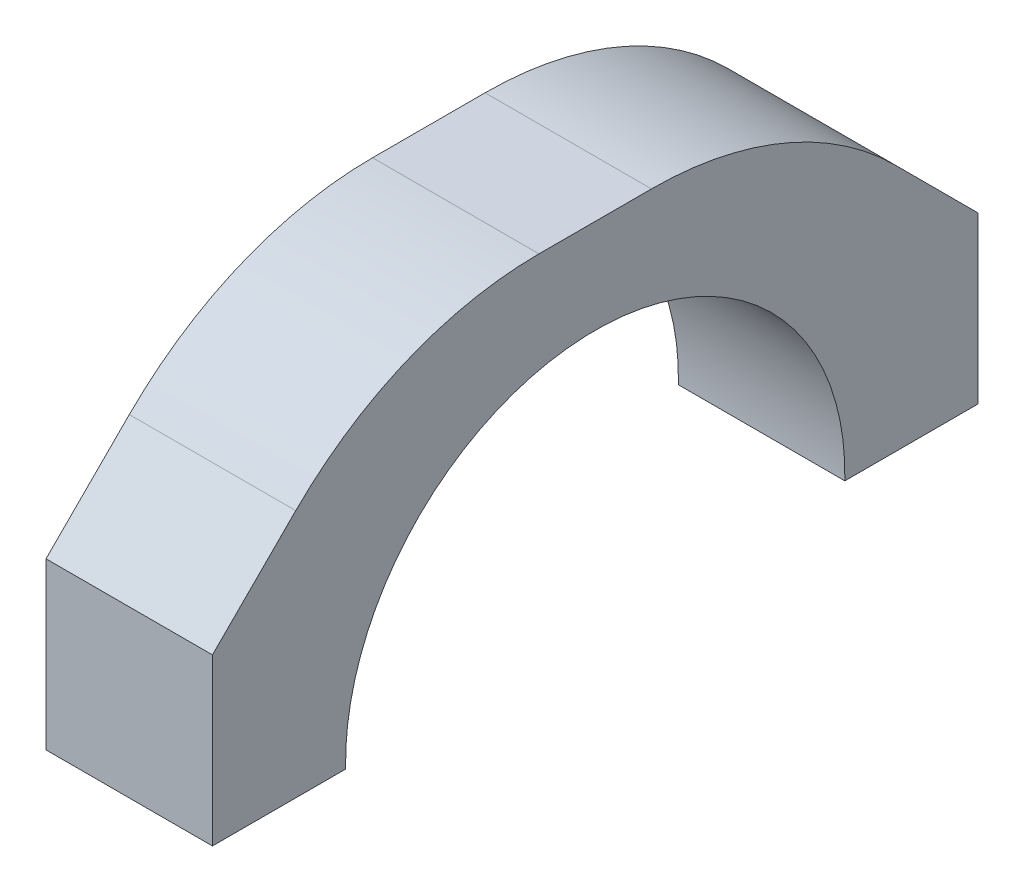
from build123d import *

# Parameters (mm, degrees)
BOSS_EXTRUDE1_DEPTH = 12
CHAMFER1_SIZE       = 16
FILLET1_R           = 30
BOSS_EXTRUDE3_DEPTH = 15


with BuildPart() as part:
    # Sketch1 → Boss-Extrude1 (new body)
    with BuildSketch(Plane(origin=(0, 0, 0), x_dir=(0, 0, -1), z_dir=(1, 0, 0))):
        with BuildLine():
            Line((-33.494680249, 0), (33.494680249, 0))
            Line((33.494680249, 0), (33.494680249, -29.5))
            Line((33.494680249, -29.5), (23.494680249, -29.5))
            ThreePointArc((23.494680249, -29.5), (0, -6.5), (-23.494680249, -29.5))
            Line((-23.494680249, -29.5), (-33.494680249, -29.5))
            Line((-33.494680249, -29.5), (-33.494680249, 0))
        make_face()
    extrude(amount=BOSS_EXTRUDE1_DEPTH)

    # Chamfer1
    chamfer1_edges = [part.edges().sort_by_distance(p)[0] for p in [
        (6, 0, 33.494680249),
        (6, 0, -33.494680249),
    ]]
    chamfer(chamfer1_edges, length=CHAMFER1_SIZE)

    # Fillet1
    fillet1_edges = [part.edges().sort_by_distance(p)[0] for p in [
        (6, 0, 17.494680249),
        (6, 0, -17.494680249),
    ]]
    fillet(fillet1_edges, radius=FILLET1_R)

    # Sketch6 → Boss-Extrude3 (add)
    with BuildSketch(Plane(origin=(12, 0, 0), x_dir=(0, 0, -1), z_dir=(1, 0, 0))):
        with BuildLine():
            Line((34.494680249, -15.585786438), (26.988583595, -8.079689783))
            ThreePointArc((26.988583595, -8.079689783), (16.931459781, -1.359734492), (5.068273378, 1))
            Line((5.068273378, 1), (-5.068273378, 1))
            ThreePointArc((-5.068273378, 1), (-16.931459781, -1.359734492), (-26.988583595, -8.079689783))
            Line((-26.988583595, -8.079689783), (-34.494680249, -15.585786438))
            Line((-34.494680249, -15.585786438), (-34.494680249, -30.5))
            Line((-34.494680249, -30.5), (-22.494443758, -30.5))
            ThreePointArc((-22.494443758, -30.5), (0, -7.5), (22.494443758, -30.5))
            Line((22.494443758, -30.5), (34.494680249, -30.5))
            Line((34.494680249, -30.5), (34.494680249, -15.585786438))
        make_face()
    extrude(amount=-BOSS_EXTRUDE3_DEPTH)


solid = part.part
